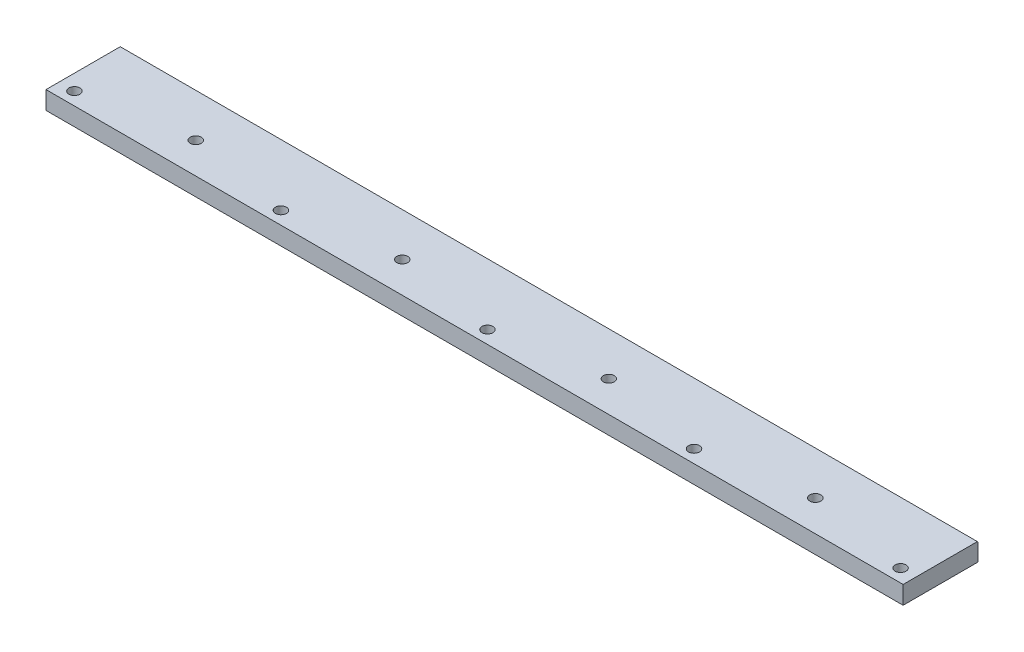
from build123d import *

# Parameters (mm, degrees)
SKETCH1_W           = 2108.2
SKETCH1_H           = 184.15
BOSS_EXTRUDE1_DEPTH = 22.225
CUT_EXTRUDE2_START  = -22.225
SKETCH2_R           = 13.4874
CUT_EXTRUDE2_DEPTH  = 88.9
CUT_EXTRUDE4_START  = -22.225
SKETCH3_R           = 19.8374
CUT_EXTRUDE4_DEPTH  = 25.4
CUT_EXTRUDE6_START  = -22.225
SKETCH4_R           = 13.4874
CUT_EXTRUDE6_DEPTH  = 88.9
CUT_EXTRUDE8_START  = -22.225
SKETCH5_R           = 19.8374
CUT_EXTRUDE8_DEPTH  = 25.4
CHAMFER1_SIZE       = 1.524


with BuildPart() as part:
    # Sketch1 → Boss-Extrude1 (new, symmetric)
    with BuildSketch(Plane(origin=(0, 0, 0), x_dir=(1, 0, 0), z_dir=(0, 1, 0))):
        Rectangle(SKETCH1_W, SKETCH1_H)
    extrude(amount=BOSS_EXTRUDE1_DEPTH, both=True)

    # Sketch2 → Cut-Extrude2 (cut)
    with BuildSketch(Plane(origin=(0, 0, 0), x_dir=(1, 0, 0), z_dir=(0, 1, 0)).offset(CUT_EXTRUDE2_START)):
        with Locations(Location((-1016, -60.325, 0), (0, 0, 90))):
            Circle(SKETCH2_R)
        with Locations(Location((-508, -60.325, 0), (0, 0, 90))):
            Circle(SKETCH2_R)
        with Locations(Location((0, -60.325, 0), (0, 0, 90))):
            Circle(SKETCH2_R)
        with Locations(Location((508, -60.325, 0), (0, 0, 90))):
            Circle(SKETCH2_R)
        with Locations(Location((1016, -60.325, 0), (0, 0, 90))):
            Circle(SKETCH2_R)
    extrude(amount=CUT_EXTRUDE2_DEPTH, mode=Mode.SUBTRACT)

    # Sketch3 → Cut-Extrude4 (cut)
    with BuildSketch(Plane(origin=(0, 0, 0), x_dir=(1, 0, 0), z_dir=(0, 1, 0)).offset(CUT_EXTRUDE4_START)):
        with Locations(Location((-1016, -60.325, 0), (0, 0, 270))):
            Circle(SKETCH3_R)
        with Locations(Location((-508, -60.325, 0), (0, 0, 270))):
            Circle(SKETCH3_R)
        with Locations(Location((0, -60.325, 0), (0, 0, 270))):
            Circle(SKETCH3_R)
        with Locations(Location((508, -60.325, 0), (0, 0, 270))):
            Circle(SKETCH3_R)
        with Locations(Location((1016, -60.325, 0), (0, 0, 270))):
            Circle(SKETCH3_R)
    extrude(amount=CUT_EXTRUDE4_DEPTH, mode=Mode.SUBTRACT)

    # Sketch4 → Cut-Extrude6 (cut)
    with BuildSketch(Plane(origin=(0, 0, 0), x_dir=(1, 0, 0), z_dir=(0, 1, 0)).offset(CUT_EXTRUDE6_START)):
        with Locations(Location((-762, -15.875, 0), (0, 0, 90))):
            Circle(SKETCH4_R)
        with Locations(Location((-254, -15.875, 0), (0, 0, 90))):
            Circle(SKETCH4_R)
        with Locations(Location((254, -15.875, 0), (0, 0, 90))):
            Circle(SKETCH4_R)
        with Locations(Location((762, -15.875, 0), (0, 0, 90))):
            Circle(SKETCH4_R)
    extrude(amount=CUT_EXTRUDE6_DEPTH, mode=Mode.SUBTRACT)

    # Sketch5 → Cut-Extrude8 (cut)
    with BuildSketch(Plane(origin=(0, 0, 0), x_dir=(1, 0, 0), z_dir=(0, 1, 0)).offset(CUT_EXTRUDE8_START)):
        with Locations(Location((-762, -15.875, 0), (0, 0, 270))):
            Circle(SKETCH5_R)
        with Locations(Location((-254, -15.875, 0), (0, 0, 270))):
            Circle(SKETCH5_R)
        with Locations(Location((254, -15.875, 0), (0, 0, 270))):
            Circle(SKETCH5_R)
        with Locations(Location((762, -15.875, 0), (0, 0, 270))):
            Circle(SKETCH5_R)
    extrude(amount=CUT_EXTRUDE8_DEPTH, mode=Mode.SUBTRACT)

    # Chamfer1
    chamfer1_edges = [part.edges().sort_by_distance(p)[0] for p in [
        (0, -22.225, -92.075),
        (0, 22.225, -92.075),
    ]]
    chamfer(chamfer1_edges, length=CHAMFER1_SIZE)


solid = part.part
